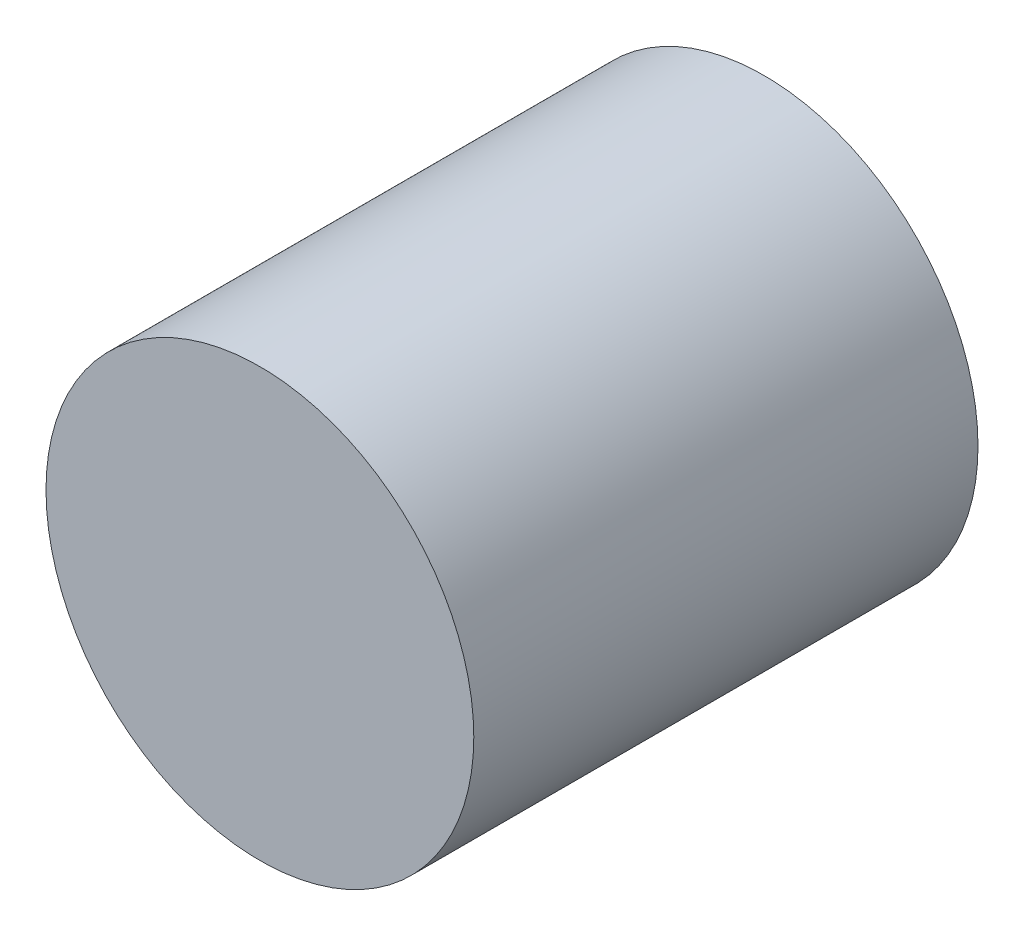
from build123d import *

# Parameters (mm, degrees)
SKETCH1_R           = 14
BOSS_EXTRUDE1_DEPTH = 33


with BuildPart() as part:
    # Sketch1 → Boss-Extrude1 (new body)
    with BuildSketch(Plane.XY):
        Circle(SKETCH1_R)
    extrude(amount=BOSS_EXTRUDE1_DEPTH)


solid = part.part
